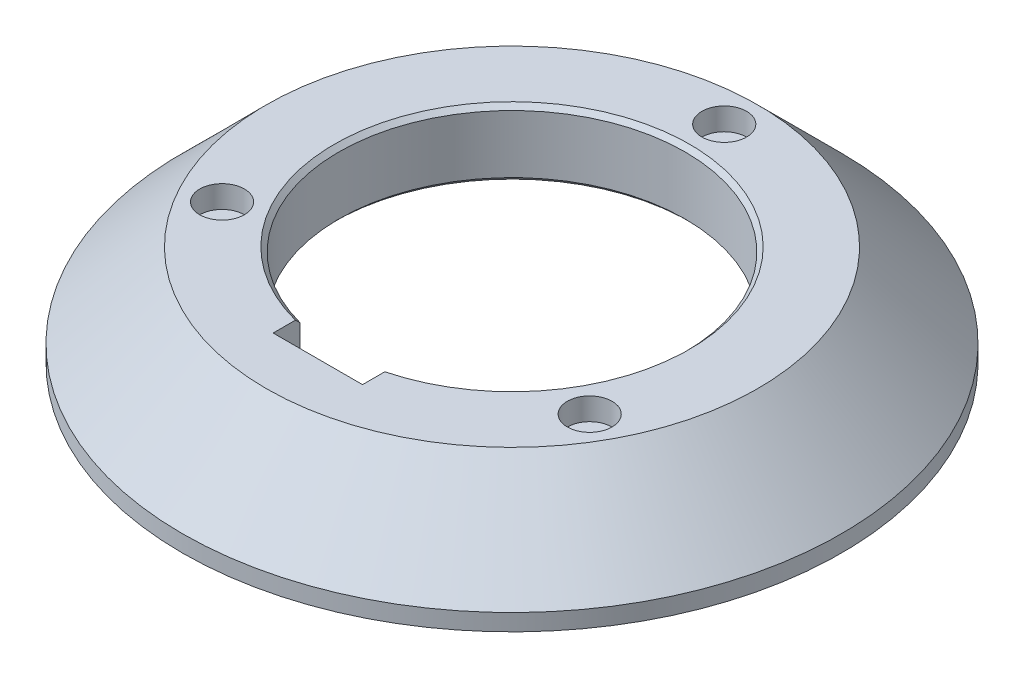
from build123d import *

# Parameters (mm, degrees)
CHAMFER_1_SIZE           = 2
SKETCH_2_R               = 10
CUT_EXTRUDE_1_DEPTH      = 10
PATTERN_CIRCULAR_1_COUNT = 3
CUT_EXTRUDE_2_DEPTH      = 214.395173329
CUT_EXTRUDE_2_DEPTH_BACK = 214.395173329
SKETCH_3_W               = 40
SKETCH_3_H               = 24.854018102
SKETCH_4_R               = 4
CUT_EXTRUDE_3_DEPTH      = 8
PATTERN_CIRCULAR_2_COUNT = 8


with BuildPart() as part:
    # Эскиз1 → Повернуть1 (revolve)
    with BuildSketch(Plane.XY, mode=Mode.PRIVATE) as revolve_1_sk:
        Polygon((77.5, 30), (77.5, 0), (117.5, 0), (132.5, -15), (147.5, -15), (147.5, -7.5), (110, 30), align=None)
    revolve(revolve_1_sk.sketch.rotate(Axis((0, 107.750556793, 0), (0, -1, 0)), 90), axis=Axis((0, 107.750556793, 0), (0, -1, 0)))

    # Фаска1
    chamfer_1_edges = [part.edges().sort_by_distance(p)[0] for p in [
        (0, 0, -77.5),
        (0, 30, -77.5),
    ]]
    chamfer(chamfer_1_edges, length=CHAMFER_1_SIZE)

    # Эскиз2 → Вырез-Вытянуть1 (cut)
    with BuildSketch(Plane(origin=(0, 30, 0), x_dir=(1, 0, 0), z_dir=(0, 1, 0))):
        with Locations(Location((0, 95, 0), (0, 0, 270))):
            Circle(SKETCH_2_R)
    cut_extrude_1 = extrude(amount=-CUT_EXTRUDE_1_DEPTH, mode=Mode.SUBTRACT)

    # Круговой массив1: Вырез-Вытянуть1 ×3 about axis
    pattern_circular_1_axis = Axis((0, 0, 0), (0, 1, 0))
    for i in range(1, PATTERN_CIRCULAR_1_COUNT):
        add(cut_extrude_1.rotate(pattern_circular_1_axis, i * 360 / PATTERN_CIRCULAR_1_COUNT), mode=Mode.SUBTRACT)

    # Эскиз3 → Вырез-Вытянуть2 (cut, two sides: drawn at the far end of the back side and taken through both)
    with BuildSketch(Plane(origin=(0, 30, 0), x_dir=(1, 0, 0), z_dir=(0, 1, 0)).offset(-CUT_EXTRUDE_2_DEPTH_BACK)):
        with Locations((0, -74.472990949)):
            Rectangle(SKETCH_3_W, SKETCH_3_H)
    extrude(amount=CUT_EXTRUDE_2_DEPTH + CUT_EXTRUDE_2_DEPTH_BACK, mode=Mode.SUBTRACT)

    # Эскиз4 → Вырез-Вытянуть3 (cut)
    with BuildSketch(Plane.XZ):
        with Locations(Location((0, 100, 0), (0, 0, 270))):
            Circle(SKETCH_4_R)
    cut_extrude_3 = extrude(amount=-CUT_EXTRUDE_3_DEPTH, mode=Mode.SUBTRACT)

    # Круговой массив2: Вырез-Вытянуть3 ×8 about axis
    pattern_circular_2_axis = Axis((0, 0, 0), (0, 1, 0))
    for i in range(1, PATTERN_CIRCULAR_2_COUNT):
        add(cut_extrude_3.rotate(pattern_circular_2_axis, i * 360 / PATTERN_CIRCULAR_2_COUNT), mode=Mode.SUBTRACT)


solid = part.part
